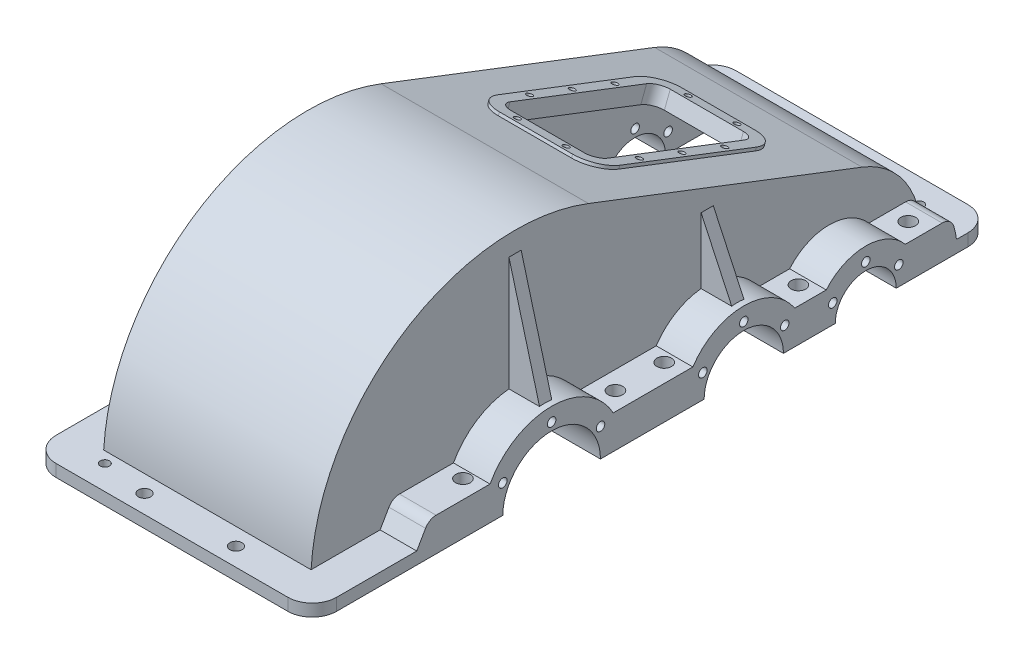
from build123d import *

# Parameters (mm, degrees)
BOSS_EXTRUDE1_DEPTH            = 170
SHELL1_T                       = -21.8
SKETCH2_W                      = 460.00000000000006
SKETCH2_H                      = 1115
SKETCH2_W_2                    = 340
SKETCH2_H_2                    = 1000.0000000000001
SKETCH2_W_3                    = 296.4
SKETCH2_H_3                    = 956.4
BOSS_EXTRUDE4_DEPTH            = 20
FILLET1_R                      = 40
CUT_EXTRUDE2_DEPTH             = 690.8777065538501
CUT_EXTRUDE2_DEPTH_BACK        = 690.8777065538501
SKETCH6_R                      = 80
SKETCH6_R_2                    = 65.00000000000001
SKETCH6_R_3                    = 50.00000000000001
BOSS_EXTRUDE5_START            = 230
BOSS_EXTRUDE5_DEPTH            = 60
CUT_EXTRUDE3_DEPTH             = 681.3905128674268
CUT_EXTRUDE3_DEPTH_BACK        = 20
SKETCH8_R                      = 12.000000000000007
SKETCH8_R_2                    = 12.000000000000005
FILLET2_R                      = 20
SKETCH9_R                      = 9.999999999999996
CUT_EXTRUDE4_DEPTH             = 20
CUT_EXTRUDE6_DEPTH             = 690.8777065538501
CUT_EXTRUDE6_DEPTH_BACK        = 690.8777065538501
SKETCH11_W                     = 421.7359560517455
SKETCH11_H                     = 626.9047995363773
SKETCH11_H_2                   = 604.1082613714203
CUT_EXTRUDE7_DEPTH             = 681.3905128674268
CUT_EXTRUDE7_DEPTH_BACK        = 681.3905128674268
SKETCH10_R                     = 7.500000000000014
SKETCH10_R_2                   = 7.500000000000008
CUT_EXTRUDE8_DEPTH             = 797.637464597291
CUT_EXTRUDE8_DEPTH_BACK        = 797.637464597291
SKETCH12_R                     = 7.000000000000015
SKETCH12_R_2                   = 7.000000000000017
SKETCH12_R_3                   = 7.000000000000049
SKETCH12_R_4                   = 7.000000000000029
SKETCH12_R_5                   = 7.000000000000024
SKETCH12_R_6                   = 7.0000000000000355
SKETCH12_R_7                   = 7.000000000000028
SKETCH12_R_8                   = 7.000000000000025
SKETCH12_R_9                   = 7.000000000000035
SKETCH12_R_10                  = 6.999999999999988
SKETCH12_R_11                  = 6.999999999999926
SKETCH12_R_12                  = 6.9999999999999485
SKETCH12_R_13                  = 6.999999999999976
SKETCH12_R_14                  = 7.000000000000004
SKETCH12_R_15                  = 7.000000000000027
RIB1_REACH                     = 830.934
SKETCH13_WALL_W                = 1853.0527715521177
SKETCH13_WALL_H                = 20
RIB2_REACH                     = 817.893
SKETCH14_WALL_W                = 1752.5749517493573
SKETCH14_WALL_H                = 20
CUT_EXTRUDE9_REACH             = 743.735
SKETCH15_W                     = 160
SKETCH15_H                     = 280
CUT_EXTRUDE9_DIRECTION_2_DEPTH = 742.7349669956388
FILLET3_R                      = 20
BOSS_EXTRUDE6_DEPTH            = 5
SKETCH18_R                     = 4.999999999999998
SKETCH18_R_2                   = 5.000000000000005
SKETCH18_R_3                   = 5.0000000000000036
SKETCH18_R_4                   = 4.9999999999999964
CUT_EXTRUDE10_DEPTH            = 5


with BuildPart() as part:
    # Sketch1 → Boss-Extrude1 (new, symmetric)
    with BuildSketch(Plane(origin=(0, 0, 0), x_dir=(0, 0, -1), z_dir=(1, 0, 0))):
        with BuildLine():
            Line((-500, 0), (500, 0))
            ThreePointArc((500, 0), (473.6578430020609, 84.90428648824316), (403.88349514563106, 139.9877457168689))
            Line((403.88349514563106, 139.9877457168689), (-44.66019417475718, 312.639298767674))
            ThreePointArc((-44.66019417475718, 312.639298767674), (-354.6195731570764, 276.1691827046027), (-500, 0))
        make_face()
    extrude(amount=BOSS_EXTRUDE1_DEPTH, both=True)

    # Shell1
    shell1_openings = [part.faces().sort_by_distance(p)[0] for p in [
        (0, 0, 0),
    ]]
    offset(amount=SHELL1_T, openings=shell1_openings, kind=Kind.INTERSECTION)

    # Sketch2 → Boss-Extrude4 (add)
    # profile 1 of 2: a face of its own
    with BuildSketch(Plane.XZ):
        Rectangle(SKETCH2_W, SKETCH2_H)
        Rectangle(SKETCH2_W_2, SKETCH2_H_2, mode=Mode.SUBTRACT)
    # profile 2 of 2: a face of its own
    with BuildSketch(Plane.XZ):
        Rectangle(SKETCH2_W_2, SKETCH2_H_2)
        Rectangle(SKETCH2_W_3, SKETCH2_H_3, mode=Mode.SUBTRACT)
    extrude(amount=-BOSS_EXTRUDE4_DEPTH)

    # Fillet1
    fillet1_edges = [part.edges().sort_by_distance(p)[0] for p in [
        (230, 10, -557.5),
        (-230, 10, -557.5),
        (-230, 10, 557.5),
        (230, 10, 557.5),
    ]]
    fillet(fillet1_edges, radius=FILLET1_R)

    # Sketch6 → Cut-Extrude2 (cut, two sides: drawn at the far end of the back side and taken through both)
    with BuildSketch(Plane(origin=(0, 0, 0), x_dir=(0, 0, -1), z_dir=(1, 0, 0)).offset(-CUT_EXTRUDE2_DEPTH_BACK)):
        with Locations((-165, 0)):
            Circle(SKETCH6_R)
        with Locations((149.99999999999997, 0)):
            Circle(SKETCH6_R_2)
        with Locations((350, 0)):
            Circle(SKETCH6_R_3)
    extrude(amount=CUT_EXTRUDE2_DEPTH + CUT_EXTRUDE2_DEPTH_BACK, mode=Mode.SUBTRACT)

    # Sketch7 → Boss-Extrude5 (add)
    with BuildSketch(Plane(origin=(0, 0, 0), x_dir=(0, 0, -1), z_dir=(1, 0, 0)).offset(BOSS_EXTRUDE5_START)):
        with BuildLine():
            Line((395.8257569495584, 20), (498.660687473185, 20))
            ThreePointArc((498.660687473185, 20), (495.1654637222667, 37.77549658574017), (489.5528573695286, 55.00000000000001))
            Line((489.5528573695286, 55.00000000000001), (414.80740698407857, 55.00000000000001))
            ThreePointArc((414.80740698407857, 55.00000000000001), (349.99999999999994, 84.99999999999997), (285.1925930159214, 55.00000000000001))
            Line((285.1925930159214, 55.00000000000001), (233.51646544245034, 55.00000000000001))
            ThreePointArc((233.51646544245034, 55.00000000000001), (149.99999999999997, 100.00000000000004), (66.4835345575496, 55.00000000000001))
            Line((66.4835345575496, 55.00000000000001), (-64.00495061637925, 55.00000000000001))
            ThreePointArc((-64.00495061637925, 55.00000000000001), (-165, 114.99999999999999), (-265.99504938362077, 55.00000000000001))
            Line((-265.99504938362077, 55.00000000000001), (-365.9950493836208, 54.99999999999995))
            Line((-365.9950493836208, 54.99999999999995), (-386.20230880525787, 20.000000000000004))
            Line((-386.20230880525787, 20.000000000000004), (-242.45966692414834, 20))
            ThreePointArc((-242.45966692414834, 20), (-165, 80), (-87.54033307585166, 20))
            Line((-87.54033307585166, 20), (88.15341561573504, 20))
            ThreePointArc((88.15341561573504, 20), (149.99999999999997, 65.00000000000001), (211.8465843842649, 20))
            Line((211.8465843842649, 20), (304.17424305044153, 20))
            ThreePointArc((304.17424305044153, 20), (350, 50.00000000000001), (395.8257569495584, 20))
        make_face()
    extrude(amount=-BOSS_EXTRUDE5_DEPTH)

    # Sketch8 → Cut-Extrude3 (cut, two sides: drawn at the far end of the back side and taken through both)
    with BuildSketch(Plane(origin=(0, 20, 0), x_dir=(1, 0, 0), z_dir=(0, 1, 0)).offset(-CUT_EXTRUDE3_DEPTH_BACK)):
        with Locations(Location((200, 449.5528573695286, 0), (0, 0, 270))):
            Circle(SKETCH8_R)
        with Locations(Location((200.00000000000006, 269.5528573695286, 0), (0, 0, 270))):
            Circle(SKETCH8_R)
        with Locations(Location((200.00000000000009, 49.55285736952861, 0), (0, 0, 270))):
            Circle(SKETCH8_R_2)
        with Locations(Location((200.00000000000009, -30.447142630471394, 0), (0, 0, 270))):
            Circle(SKETCH8_R_2)
        with Locations(Location((200.00000000000006, -280.4471426304714, 0), (0, 0, 270))):
            Circle(SKETCH8_R)
    extrude(amount=CUT_EXTRUDE3_DEPTH + CUT_EXTRUDE3_DEPTH_BACK, mode=Mode.SUBTRACT)

    # Fillet2
    fillet2_edges = [part.edges().sort_by_distance(p)[0] for p in [
        (200, 54.99999999999995, 365.9950493836208),
        (200, 55.000000000000014, -489.5528573695286),
    ]]
    fillet(fillet2_edges, radius=FILLET2_R)

    # Sketch9 → Cut-Extrude4 (cut)
    with BuildSketch(Plane(origin=(0, 20, 0), x_dir=(1, 0, 0), z_dir=(0, 1, 0))):
        with Locations(Location((74.9999999999999, 527.5, 0), (0, 0, 270))):
            Circle(SKETCH9_R)
        with Locations(Location((75.00000000000001, -527.5, 0), (0, 0, 270))):
            Circle(SKETCH9_R)
    extrude(amount=-CUT_EXTRUDE4_DEPTH, mode=Mode.SUBTRACT)

    # Sketch11 → Cut-Extrude6 (cut, two sides: drawn at the far end of the back side and taken through both)
    with BuildSketch(Plane(origin=(0, 0, 0), x_dir=(1, 0, 0), z_dir=(0, 1, 0)).offset(-CUT_EXTRUDE6_DEPTH_BACK)):
        with Locations((-210.86797802587276, 313.4523997681886)):
            Rectangle(SKETCH11_W, SKETCH11_H)
        with Locations((-210.86797802587276, -302.05413068571016)):
            Rectangle(SKETCH11_W, SKETCH11_H_2)
    extrude(amount=CUT_EXTRUDE6_DEPTH + CUT_EXTRUDE6_DEPTH_BACK, mode=Mode.SUBTRACT)

    # Mirror1: part across plane


with BuildPart() as part_1:
    add(part.part)
    add(part.part.mirror(Plane(origin=(0, -1.2e-05, 0), x_dir=(0, 0, 1), z_dir=(-1, 0, 0))))

    # Sketch10 → Cut-Extrude7 (cut, two sides: drawn at the far end of the back side and taken through both)
    with BuildSketch(Plane(origin=(0, 20, 0), x_dir=(1, 0, 0), z_dir=(0, 1, 0)).offset(-CUT_EXTRUDE7_DEPTH_BACK)):
        with Locations(Location((150.00000000000003, 517.5, 0), (0, 0, 270))):
            Circle(SKETCH10_R)
        with Locations(Location((-150.00000000000364, -517.4999999999992, 0), (0, 0, 270))):
            Circle(SKETCH10_R_2)
    extrude(amount=CUT_EXTRUDE7_DEPTH + CUT_EXTRUDE7_DEPTH_BACK, mode=Mode.SUBTRACT)

    # Sketch12 → Cut-Extrude8 (cut, two sides: drawn at the far end of the back side and taken through both)
    with BuildSketch(Plane(origin=(230, 0, 0), x_dir=(0, 0, -1), z_dir=(1, 0, 0)).offset(-CUT_EXTRUDE8_DEPTH_BACK)):
        with Locations((-165, 92.5)):
            Circle(SKETCH12_R)
        with Locations((-84.89265014993931, 46.24999999999982)):
            Circle(SKETCH12_R_2)
        with Locations((-84.8926501499396, -46.25000000000035)):
            Circle(SKETCH12_R_3)
        with Locations((-165.00000000000065, -92.49999999999999)):
            Circle(SKETCH12_R_4)
        with Locations((-245.10734985006104, -46.24999999999929)):
            Circle(SKETCH12_R_5)
        with Locations((-245.10734985006005, 46.25000000000093)):
            Circle(SKETCH12_R)
        with Locations((149.99999999999997, 77.50000000000001)):
            Circle(SKETCH12_R)
        with Locations((217.11696879329406, 38.74999999999983)):
            Circle(SKETCH12_R_6)
        with Locations((217.11696879329378, -38.750000000000284)):
            Circle(SKETCH12_R_7)
        with Locations((149.9999999999995, -77.50000000000003)):
            Circle(SKETCH12_R_8)
        with Locations((82.88303120670562, -38.74999999999938)):
            Circle(SKETCH12_R_9)
        with Locations((82.88303120670639, 38.75000000000078)):
            Circle(SKETCH12_R)
        with Locations((350, 62.500000000000014)):
            Circle(SKETCH12_R_10)
        with Locations((404.12658773652754, 31.249999999999833)):
            Circle(SKETCH12_R_11)
        with Locations((404.1265877365274, -31.250000000000277)):
            Circle(SKETCH12_R_12)
        with Locations((349.99999999999955, -62.500000000000014)):
            Circle(SKETCH12_R_13)
        with Locations((295.87341226347223, -31.2499999999995)):
            Circle(SKETCH12_R_14)
        with Locations((295.87341226347286, 31.25000000000061)):
            Circle(SKETCH12_R_15)
    extrude(amount=CUT_EXTRUDE8_DEPTH + CUT_EXTRUDE8_DEPTH_BACK, mode=Mode.SUBTRACT)

    # Sketch13 wall → Rib1 (add, up to next)
    with BuildSketch(Plane(origin=(195, 208.301270189, 165), x_dir=(-0.258819045103, 0.965925826289, 0), z_dir=(-0.965925826289, -0.258819045103, 0)), mode=Mode.PRIVATE) as rib1_sk1:
        Rectangle(SKETCH13_WALL_W, SKETCH13_WALL_H)
    rib1_tool1 = extrude(rib1_sk1.sketch, amount=RIB1_REACH, mode=Mode.PRIVATE) - part_1.part
    rib1 = rib1_tool1.solids().sort_by_distance((195, 208.301270189, 165))[0]
    add(rib1)

    # Sketch14 wall → Rib2 (add, up to next)
    with BuildSketch(Plane(origin=(194.898774251, 153.829752332, -150), x_dir=(-0.422618261737, 0.906307787038, 0), z_dir=(-0.906307787038, -0.422618261737, 0)), mode=Mode.PRIVATE) as rib2_sk1:
        Rectangle(SKETCH14_WALL_W, SKETCH14_WALL_H)
    rib2_tool1 = extrude(rib2_sk1.sketch, amount=RIB2_REACH, mode=Mode.PRIVATE) - part_1.part
    rib2 = rib2_tool1.solids().sort_by_distance((194.898774251, 153.829752332, -150))[0]
    add(rib2)

    # Mirror2: Rib1, Rib2 across plane
    add(rib1.mirror(Plane(origin=(0, 0, 0), x_dir=(0, 0, 1), z_dir=(1, 0, 0))))
    add(rib2.mirror(Plane(origin=(0, 0, 0), x_dir=(0, 0, 1), z_dir=(1, 0, 0))))

    # Sketch15 → Cut-Extrude9 (cut, up to next)
    with BuildSketch(Plane(origin=(0, 257.32375264460063, -99.04797813177503), x_dir=(1, 0, 0), z_dir=(0, 0.9332516381124595, -0.3592233009708742)), mode=Mode.PRIVATE) as cut_extrude9_sk1:
        with Locations((-1.421e-14, 94.22904209684195)):
            Rectangle(SKETCH15_W, SKETCH15_H)
    cut_extrude9_tool1 = extrude(cut_extrude9_sk1.sketch, amount=-CUT_EXTRUDE9_REACH, mode=Mode.PRIVATE) & part_1.part
    add(cut_extrude9_tool1.solids().sort_by_distance((0, 223.474485, -186.987386))[0], mode=Mode.SUBTRACT)

    # Sketch15 → Cut-Extrude9 direction 2 (cut)
    with BuildSketch(Plane(origin=(0, 257.32375264460063, -99.04797813177503), x_dir=(1, 0, 0), z_dir=(0, 0.9332516381124595, -0.3592233009708742))):
        with Locations((-1.421e-14, 94.22904209684195)):
            Rectangle(SKETCH15_W, SKETCH15_H)
    extrude(amount=CUT_EXTRUDE9_DIRECTION_2_DEPTH, mode=Mode.SUBTRACT)

    # Fillet3
    fillet3_edges = [part_1.edges().sort_by_distance(p)[0] for p in [
        (-80.00000000000001, 163.01078010390137, -313.7270813815825),
        (-80.00000000000001, 263.59330437574613, -52.41662271009382),
        (79.99999999999999, 263.59330437574613, -52.41662271009382),
        (79.99999999999999, 163.01078010390137, -313.7270813815825),
    ]]
    fillet(fillet3_edges, radius=FILLET3_R)

    # Sketch17 → Boss-Extrude6 (add)
    with BuildSketch(Plane(origin=(0, 257.32375264460063, -99.04797813177503), x_dir=(1, 0, 0), z_dir=(0, 0.9332516381124595, -0.3592233009708742))):
        with BuildLine():
            Line((-99.99999999999999, -25.770957903158227), (-99.99999999999999, 214.2290420968419))
            ThreePointArc((-99.99999999999999, 214.2290420968419), (-88.28427124746194, 242.51331334430387), (-60.000000000000036, 254.229042096842))
            Line((-60.000000000000036, 254.229042096842), (60, 254.22904209684205))
            ThreePointArc((60, 254.22904209684205), (88.28427124746196, 242.51331334430387), (99.99999999999997, 214.22904209684185))
            Line((99.99999999999997, 214.22904209684185), (99.99999999999999, -25.770957903158227))
            ThreePointArc((99.99999999999999, -25.770957903158227), (88.28427124746185, -54.055229150620036), (59.99999999999998, -65.77095790315809))
            Line((59.99999999999998, -65.77095790315809), (-60.00000000000003, -65.7709579031581))
            ThreePointArc((-60.00000000000003, -65.7709579031581), (-88.28427124746185, -54.05522915062001), (-99.99999999999999, -25.770957903158227))
        make_face()
        with BuildLine():
            Line((-79.99999999999999, -25.770957903158227), (-79.99999999999999, 214.2290420968419))
            ThreePointArc((-79.99999999999999, 214.2290420968419), (-74.14213562373101, 228.37117772057292), (-60.00000000000003, 234.22904209684202))
            Line((-60.00000000000003, 234.22904209684202), (60, 234.22904209684202))
            ThreePointArc((60, 234.22904209684202), (74.14213562373098, 228.37117772057297), (79.99999999999999, 214.22904209684197))
            Line((79.99999999999999, 214.22904209684197), (79.99999999999999, -25.770957903158227))
            ThreePointArc((79.99999999999999, -25.770957903158227), (74.14213562373091, -39.91309352688911), (59.999999999999986, -45.77095790315811))
            Line((59.999999999999986, -45.77095790315811), (-60.00000000000003, -45.77095790315811))
            ThreePointArc((-60.00000000000003, -45.77095790315811), (-74.1421356237309, -39.91309352688906), (-79.99999999999999, -25.770957903158227))
        make_face(mode=Mode.SUBTRACT)
    extrude(amount=BOSS_EXTRUDE6_DEPTH)

    # Sketch18 → Cut-Extrude10 (cut)
    with BuildSketch(Plane(origin=(0, 261.990010835163, -100.84409463662948), x_dir=(1, 0, 0), z_dir=(0, 0.9332516381124594, -0.35922330097087424))):
        with Locations(Location((40, 244.22904209684205, 0), (0, 0, 270))):
            Circle(SKETCH18_R)
        with Locations(Location((89.99999999999999, 169.22904209684197, 0), (0, 0, 270))):
            Circle(SKETCH18_R_2)
        with Locations(Location((90, 94.22904209684191, 0), (0, 0, 270))):
            Circle(SKETCH18_R_2)
        with Locations(Location((90, 19.229042096841926, 0), (0, 0, 270))):
            Circle(SKETCH18_R_3)
        with Locations(Location((39.99999999999999, -55.770957903158134, 0), (0, 0, 270))):
            Circle(SKETCH18_R_4)
        with Locations(Location((-39.99999999999999, -55.770957903158134, 0), (0, 0, 90))):
            Circle(SKETCH18_R_4)
        with Locations(Location((-90, 19.229042096841926, 0), (0, 0, 90))):
            Circle(SKETCH18_R_3)
        with Locations(Location((-90, 94.22904209684191, 0), (0, 0, 90))):
            Circle(SKETCH18_R_2)
        with Locations(Location((-89.99999999999999, 169.22904209684197, 0), (0, 0, 90))):
            Circle(SKETCH18_R_2)
        with Locations(Location((-40, 244.22904209684205, 0), (0, 0, 90))):
            Circle(SKETCH18_R)
    extrude(amount=-CUT_EXTRUDE10_DEPTH, mode=Mode.SUBTRACT)


solid = part_1.part
